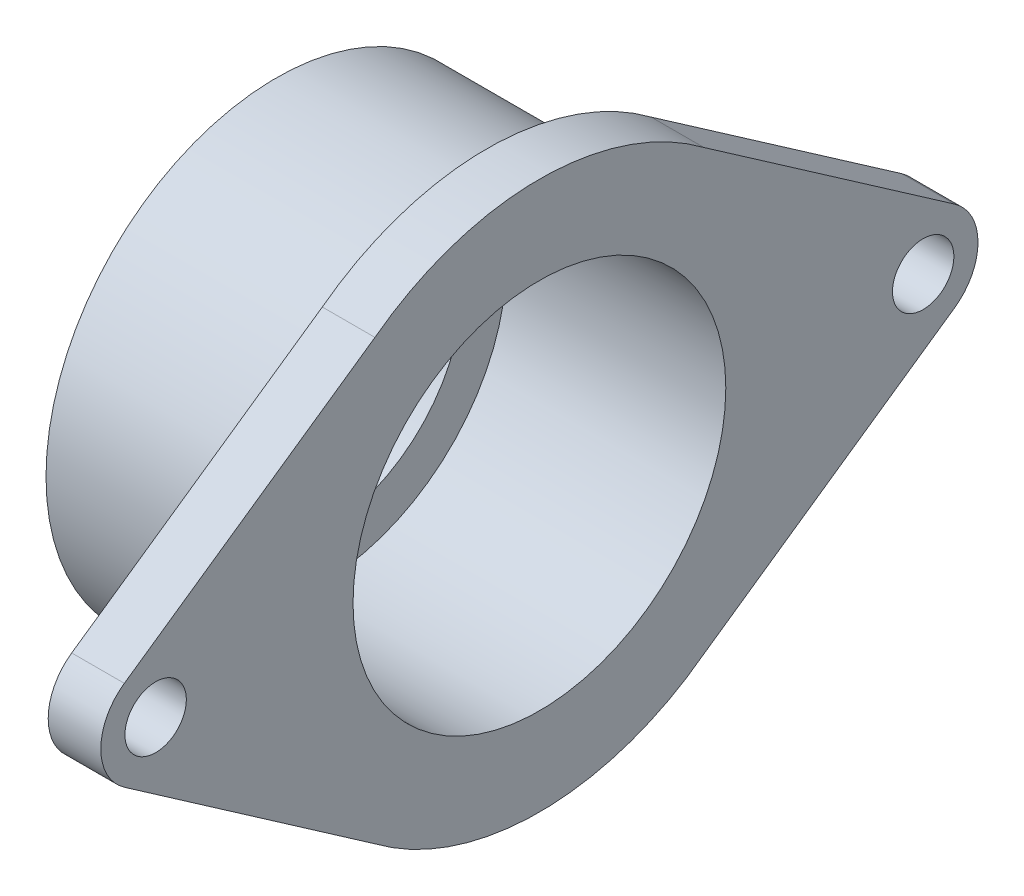
from build123d import *

# Parameters (mm, degrees)
BOSS_EXTRUDE1_START     = -12
SKETCH2_R               = 52.5
BOSS_EXTRUDE1_DEPTH     = 12
CUT_EXTRUDE1_DEPTH      = 158.743730759
CUT_EXTRUDE1_DEPTH_BACK = 158.743730759
SKETCH3_R               = 7


with BuildPart() as part:
    # Sketch1 → Revolve1 (revolve)
    with BuildSketch(Plane.XY, mode=Mode.PRIVATE) as revolve1_sk:
        Polygon((-43.504823151, -1.221864952), (6.495176849, -1.221864952), (6.495176849, 8.778135048), (-53.504823151, 8.778135048), (-53.504823151, -11.221864952), (-43.504823151, -11.221864952), align=None)
    revolve(revolve1_sk.sketch.rotate(Axis((-50.064308682, -43.721864952, 0), (1, 0, 0)), 90), axis=Axis((-50.064308682, -43.721864952, 0), (1, 0, 0)))

    # Sketch2 → Boss-Extrude1 (add)
    with BuildSketch(Plane(origin=(6.495176849, 0, 0), x_dir=(0, 0, -1), z_dir=(1, 0, 0)).offset(BOSS_EXTRUDE1_START)):
        with BuildLine():
            Line((-37.500000001, -93.721864951), (-94.637131817, -53.983996769))
            ThreePointArc((-94.637131817, -53.983996769), (-100, -43.721864952), (-94.637131817, -33.459733135))
            Line((-94.637131817, -33.459733135), (-37.500000001, 6.278135048))
            ThreePointArc((-37.500000001, 6.278135048), (0, 18.778135048), (37.500000001, 6.278135048))
            Line((37.500000001, 6.278135048), (94.637131817, -33.459733135))
            ThreePointArc((94.637131817, -33.459733135), (100, -43.721864952), (94.637131817, -53.983996769))
            Line((94.637131817, -53.983996769), (37.500000001, -93.721864951))
            ThreePointArc((37.500000001, -93.721864951), (0, -106.221864952), (-37.500000001, -93.721864951))
        make_face()
        with Locations(Location((0, -43.721864952, 0), (0, 0, 180))):
            Circle(SKETCH2_R, mode=Mode.SUBTRACT)
    extrude(amount=BOSS_EXTRUDE1_DEPTH)

    # Sketch3 → Cut-Extrude1 (cut, two sides: drawn at the far end of the back side and taken through both)
    with BuildSketch(Plane(origin=(6.495176849, 0, 0), x_dir=(0, 0, -1), z_dir=(1, 0, 0)).offset(-CUT_EXTRUDE1_DEPTH_BACK)):
        with Locations((87.5, -43.721864952)):
            Circle(SKETCH3_R)
        with Locations((-87.5, -43.721864952)):
            Circle(SKETCH3_R)
    extrude(amount=CUT_EXTRUDE1_DEPTH + CUT_EXTRUDE1_DEPTH_BACK, mode=Mode.SUBTRACT)


solid = part.part
